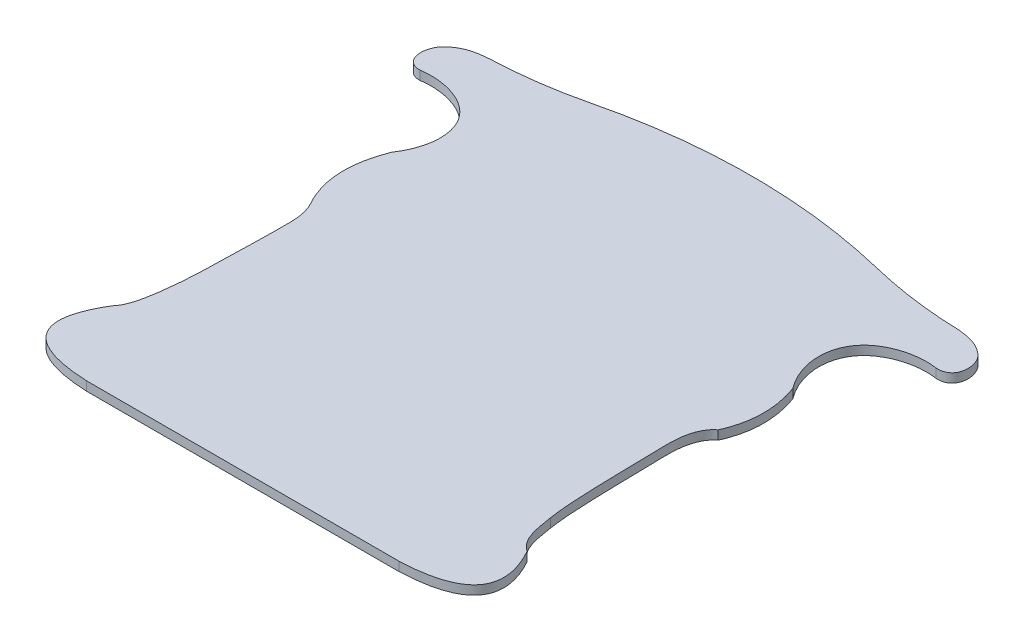
from build123d import *

# Parameters (mm, degrees)
EXTRUDE_1_DEPTH = 3


with BuildPart() as part:
    # 草图1 → 凸台-拉伸1 (new body)
    with BuildSketch(Plane(origin=(0, 0, 0), x_dir=(1, 0, 0), z_dir=(0, 1, 0))):
        with BuildLine():
            Line((0, -85.237738925), (52.08455714, -85.237738925))
            add(Edge.make_bspline(
                [(52.08455714, -85.237738925), (83.131353316, -83.963442969), (70.531928888, -61.056271567)],
                knots=[0, 0, 0, 0.91576418, 0.91576418, 0.91576418], degree=2))
            add(Edge.make_bspline(
                [(64.686979765, -47.335345252), (64.821728452, -48.22885898), (65.093128633, -50.015668979), (65.515155467, -52.234660938), (65.946662506, -53.991070652), (66.337115564, -55.291267739), (66.823261096, -56.557684193), (67.433421369, -57.768689415), (68.186549634, -58.894674775), (69.089475072, -59.904951843), (69.899928779, -60.600614164), (70.397522986, -60.962598407), (70.531928888, -61.056271567)],
                knots=[0, 0, 0, 0, 0.03125, 0.0625, 0.078125, 0.09375, 0.109375, 0.125, 0.140625, 0.15625, 0.171875, 0.177544855, 0.177544855, 0.177544855, 0.177544855], degree=3))
            add(Edge.make_bspline(
                [(67.281190845, 5.878024568), (66.896150113, 5.604067681), (66.17820277, 4.954075775), (65.443341839, 3.984844748), (64.938700468, 3.142617887), (64.602832741, 2.486533462), (64.306406192, 1.811794699), (64.046527331, 1.122513569), (63.82116748, 0.421125393), (63.628358492, -0.290103239), (63.466128453, -1.008847892), (63.332437978, -1.733031566), (63.224920724, -2.461279505), (63.112896984, -3.436590381), (63.04248237, -4.416759867), (63.002674943, -5.39935773), (62.985358555, -6.136929173), (62.977857057, -6.874572053), (62.977765693, -7.612059791), (62.982878051, -8.349301424), (62.991452287, -9.086301707), (63.002218337, -9.823125162), (63.018489212, -10.805396372), (63.040788209, -12.033099303), (63.117509988, -15.961444796), (63.209965223, -19.888985412), (63.30476302, -23.816659201), (63.346660287, -25.535031616), (63.38326061, -27.007933212), (63.421035997, -28.480829039), (63.466381834, -30.199198036), (63.537017062, -32.653910516), (63.649386664, -35.598757346), (63.806392131, -38.54169042), (64.021636354, -41.480498428), (64.260256253, -43.924290625), (64.493829102, -45.874662228), (64.622628022, -46.848447014), (64.686979765, -47.335345252)],
                knots=[0.42243117, 0.42243117, 0.42243117, 0.42243117, 0.4375, 0.453125, 0.4609375, 0.46875, 0.4765625, 0.484375, 0.4921875, 0.5, 0.5078125, 0.515625, 0.5234375, 0.53125, 0.546875, 0.5546875, 0.5625, 0.5703125, 0.578125, 0.5859375, 0.59375, 0.6015625, 0.609375, 0.625, 0.640625, 0.734375, 0.75, 0.765625, 0.7890625, 0.796875, 0.8125, 0.84375, 0.875, 0.90625, 0.9375, 0.96875, 0.984375, 1, 1, 1, 1], degree=3))
            add(Edge.make_bspline(
                [(67.78565705, 30.270686681), (72.435451847, 17.336518953), (67.281190845, 5.878024568)],
                knots=[0.041125556, 0.041125556, 0.041125556, 0.901853171, 0.901853171, 0.901853171], degree=2))
            add(Edge.make_bspline(
                [(67.78565705, 30.270686681), (61.777966314, 38.050300603), (60.870236454, 48.571265725), (67.294682301, 54.787889309)],
                knots=[0.782114211, 0.782114211, 0.782114211, 0.782114211, 1, 1, 1, 1], degree=3))
            add(Edge.make_bspline(
                [(67.294682301, 54.787889309), (70.741983298, 58.123674712), (77.208516837, 60.562602986), (83.906576895, 60.259476119), (84.838000271, 60.163270829)],
                knots=[0, 0, 0, 0, 0.116915593, 0.136015961, 0.136015961, 0.136015961, 0.136015961], degree=3))
            add(Edge.make_bspline(
                [(84.838000271, 60.163270829), (85.146981152, 60.131356669), (85.454953169, 60.093539936), (85.761414982, 60.04983651)],
                knots=[0.136015961, 0.136015961, 0.136015961, 0.136015961, 0.142352122, 0.142352122, 0.142352122, 0.142352122], degree=3))
            add(Edge.make_bspline(
                [(78.685847617, 74.813097523), (82.796268879, 74.469500522), (85.960946813, 73.439665414), (92.408972751, 67.859232167), (92.136253049, 59.602987515), (85.761414982, 60.04983651)],
                knots=[0.020704184, 0.020704184, 0.020704184, 0.020704184, 0.398408746, 0.457074244, 0.967673839, 0.967673839, 0.967673839, 0.967673839], degree=3))
            ThreePointArc((78.685847617, 74.813097523), (62.72522618, 76.083545277), (46.990944234, 79.047975372))
            ThreePointArc((46.990944234, 79.047975372), (23.665112301, 83.299995302), (0, 84.761695887))
            Line((0, 84.761695887), (0, -85.237738925))
        make_face()
        with BuildLine():
            Line((-52.08455714, -85.237738925), (0, -85.237738925))
            Line((0, -85.237738925), (0, 84.761695887))
            ThreePointArc((0, 84.761695887), (-24.143998295, 83.356825814), (-47.941899914, 79.047975372))
            ThreePointArc((-47.941899914, 79.047975372), (-62.863562899, 76.194384461), (-77.997336876, 74.864763259))
            add(Edge.make_bspline(
                [(-77.997336876, 74.864763259), (-82.495528452, 74.563753901), (-85.819969627, 73.561673882), (-92.303254227, 67.950726086), (-92.148043047, 60.049699914), (-86.326016832, 60.03052313)],
                knots=[0, 0, 0, 0, 0.398408746, 0.457074244, 0.95214781, 0.95214781, 0.95214781, 0.95214781], degree=3))
            add(Edge.make_bspline(
                [(-84.476216485, 60.232119747), (-85.0964702, 60.188510883), (-85.714404489, 60.121269756), (-86.326016832, 60.03052313)],
                knots=[0.130603984, 0.130603984, 0.130603984, 0.130603984, 0.143267662, 0.143267662, 0.143267662, 0.143267662], degree=3))
            add(Edge.make_bspline(
                [(-67.726534157, 54.787889309), (-71.173835153, 58.123674712), (-77.383070006, 60.465559796), (-83.805773382, 60.279257331), (-84.476216485, 60.232119747)],
                knots=[0, 0, 0, 0, 0.116915593, 0.130603984, 0.130603984, 0.130603984, 0.130603984], degree=3))
            add(Edge.make_bspline(
                [(-67.318940817, 31.510044314), (-62.135044836, 39.136673255), (-61.6373547, 48.895686695), (-67.726534157, 54.787889309)],
                knots=[0.793484807, 0.793484807, 0.793484807, 0.793484807, 1, 1, 1, 1], degree=3))
            add(Edge.make_bspline(
                [(-67.318940817, 31.510044314), (-73.265342886, 16.40111188), (-65.978257792, 3.284039205)],
                knots=[0, 0, 0, 1, 1, 1], degree=2))
            add(Edge.make_bspline(
                [(-65.637935545, -47.335345136), (-65.373308793, -45.388720399), (-64.924382386, -41.484539572), (-64.643005293, -36.57962883), (-64.490248654, -32.653889947), (-64.374999228, -28.726358209), (-64.257498755, -23.816569768), (-64.116872777, -17.924883735), (-64.009829941, -13.015026184), (-63.947711012, -9.577682419), (-63.927494686, -7.612641533), (-63.933645618, -5.646217447), (-64.01771328, -3.681321264), (-64.270091341, -1.731417529), (-64.514844339, -0.526384591), (-64.771670226, 0.42231228), (-64.996859302, 1.123821794), (-65.256715294, 1.813004408), (-65.553427674, 2.487173233), (-65.802759649, 2.973687329), (-65.950639045, 3.235914899), (-65.978257792, 3.284039205)],
                knots=[0, 0, 0, 0, 0.0625, 0.125, 0.15625, 0.1875, 0.25, 0.3125, 0.375, 0.40625, 0.421875, 0.4375, 0.46875, 0.484375, 0.5, 0.5078125, 0.515625, 0.5234375, 0.53125, 0.5390625, 0.540827672, 0.540827672, 0.540827672, 0.540827672], degree=3))
            add(Edge.make_bspline(
                [(-67.844738769, -56.659038975), (-67.828076267, -56.622229396), (-67.719460833, -56.379300174), (-67.532147702, -55.924331546), (-67.301765295, -55.286577262), (-67.095120003, -54.640057247), (-66.846182809, -53.769830042), (-66.575335176, -52.672735761), (-66.298095135, -51.346567808), (-66.056394972, -50.013457449), (-65.839906621, -48.675631298), (-65.705201894, -47.782116323), (-65.637935545, -47.335345136)],
                knots=[0.889226319, 0.889226319, 0.889226319, 0.889226319, 0.890625, 0.8984375, 0.90625, 0.9140625, 0.921875, 0.9375, 0.953125, 0.96875, 0.984375, 1, 1, 1, 1], degree=3))
            add(Edge.make_bspline(
                [(-69.542046847, -59.335240196), (-69.41095783, -59.185836173), (-69.140909763, -58.858719517), (-68.761007501, -58.331544507), (-68.303961157, -57.600902177), (-68.014217124, -57.033438144), (-67.844738769, -56.659038975)],
                knots=[0.852481845, 0.852481845, 0.852481845, 0.852481845, 0.859375, 0.8671875, 0.875, 0.889226319, 0.889226319, 0.889226319, 0.889226319], degree=3))
            add(Edge.make_bspline(
                [(-52.08455714, -85.237738925), (-84.277652341, -83.916393856), (-69.542046847, -59.335240196)],
                knots=[0, 0, 0, 0.949575707, 0.949575707, 0.949575707], degree=2))
        make_face()
    extrude(amount=EXTRUDE_1_DEPTH)


solid = part.part
